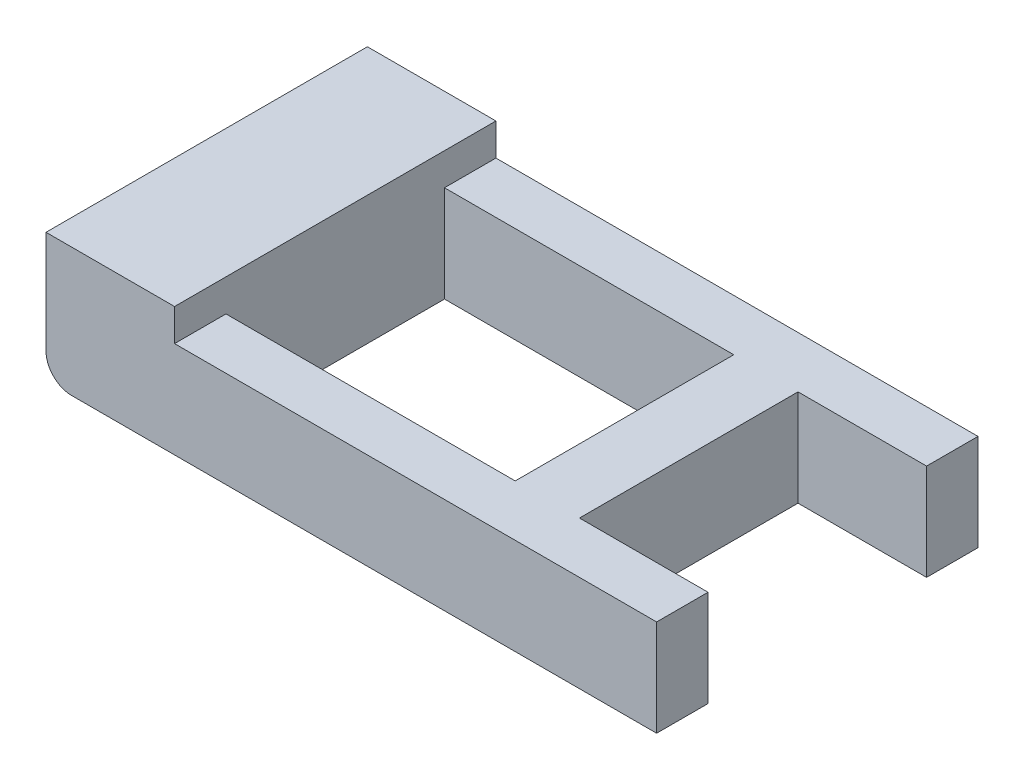
from build123d import *

# Parameters (mm, degrees)
EXTRUDE_1_DEPTH     = 50
CUT_EXTRUDE_1_DEPTH = 10
CUT_EXTRUDE_2_DEPTH = 10
EXTRUDE_2_DEPTH     = 15


with BuildPart() as part:
    # 草图1 → 凸台-拉伸1 (new body)
    with BuildSketch(Plane.XY):
        with BuildLine():
            Line((4, 0), (20, 0))
            Line((20, 0), (20, 20))
            Line((20, 20), (0, 20))
            Line((0, 20), (0, 4))
            ThreePointArc((0, 4), (1.171572875, 1.171572875), (4, 0))
        make_face()
    extrude(amount=EXTRUDE_1_DEPTH)

    # 草图2 → 切除-拉伸1 (cut)
    with BuildSketch(Plane.ZY):
        with BuildLine():
            Line((3, 15.5), (13, 15.5))
            ThreePointArc((13, 15.5), (15.65, 12.85), (13, 10.2))
            Line((13, 10.2), (3, 10.2))
            ThreePointArc((3, 10.2), (0.35, 12.85), (3, 15.5))
        make_face()
        with BuildLine():
            Line((23, 15.5), (33, 15.5))
            ThreePointArc((33, 15.5), (35.65, 12.85), (33, 10.2))
            Line((33, 10.2), (23, 10.2))
            ThreePointArc((23, 10.2), (20.35, 12.85), (23, 15.5))
        make_face()
        with BuildLine():
            Line((41, 15.5), (46, 15.5))
            ThreePointArc((46, 15.5), (48.65, 12.85), (46, 10.2))
            Line((46, 10.2), (41, 10.2))
            ThreePointArc((41, 10.2), (38.35, 12.85), (41, 15.5))
        make_face()
    extrude(amount=-CUT_EXTRUDE_1_DEPTH, mode=Mode.SUBTRACT)

    # 草图3 → 切除-拉伸2 (cut)
    with BuildSketch(Plane.XZ):
        with BuildLine():
            Line((15.5, 46), (15.5, 29))
            ThreePointArc((15.5, 29), (12.85, 26.35), (10.2, 29))
            Line((10.2, 29), (10.2, 46))
            ThreePointArc((10.2, 46), (12.85, 48.65), (15.5, 46))
        make_face()
        with BuildLine():
            Line((15.5, 20), (15.5, 5))
            ThreePointArc((15.5, 5), (12.85, 2.35), (10.2, 5))
            Line((10.2, 5), (10.2, 20))
            ThreePointArc((10.2, 20), (12.85, 22.65), (15.5, 20))
        make_face()
    extrude(amount=-CUT_EXTRUDE_2_DEPTH, mode=Mode.SUBTRACT)

    # 草图4 → 凸台-拉伸2 (add)
    with BuildSketch(Plane.XZ):
        Polygon((95, 42), (95, 50), (20, 50), (20, 42), (65, 42), (65, 8), (20, 8), (20, 0), (95, 0), (95, 8), (75, 8), (75, 42), align=None)
    extrude(amount=-EXTRUDE_2_DEPTH)


solid = part.part
